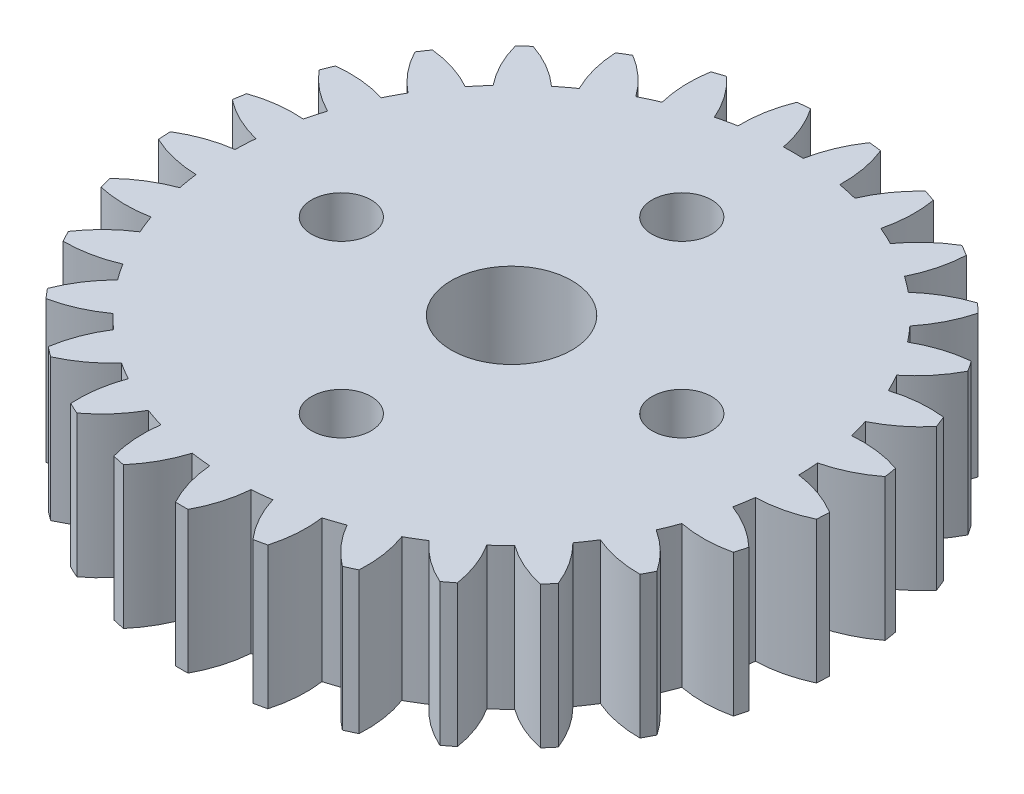
from build123d import *

# Parameters (mm, degrees)
SKETCH1_R               = 23.25
BOSS_EXTRUDE1_DEPTH     = 5
CUT_EXTRUDE1_DEPTH      = 34.258457571
CIRPATTERN1_COUNT       = 29
CUT_EXTRUDE2_DEPTH      = 35.357810434
CUT_EXTRUDE2_DEPTH_BACK = 35.357810434
SKETCH3_R               = 4.25
SKETCH4_R               = 2.1
CUT_EXTRUDE3_DEPTH      = 35.357810434
CIRPATTERN2_COUNT       = 4


with BuildPart() as part:
    # Sketch1 → Boss-Extrude1 (new, symmetric)
    with BuildSketch(Plane(origin=(0, 0, 0), x_dir=(1, 0, 0), z_dir=(0, 1, 0))):
        with Locations(Location((0, 0, 0), (0, 0, 270))):
            Circle(SKETCH1_R)
    extrude(amount=BOSS_EXTRUDE1_DEPTH, both=True)

    # Sketch2 → Cut-Extrude1 (cut, symmetric)
    with BuildSketch(Plane(origin=(0, 0, 0), x_dir=(1, 0, 0), z_dir=(0, 1, 0))):
        with BuildLine():
            ThreePointArc((0.696879992, 19.861778225), (0, 19.874), (-0.696879992, 19.861778225))
            ThreePointArc((-0.696879992, 19.861778225), (-1.219525976, 21.594414991), (-2.089327454, 23.181435589))
            ThreePointArc((-2.089327454, 23.181435589), (0, 23.2754), (2.089327454, 23.181435589))
            ThreePointArc((2.089327454, 23.181435589), (1.219525976, 21.594414991), (0.696879992, 19.861778225))
        make_face()
    cut_extrude1 = extrude(amount=CUT_EXTRUDE1_DEPTH, both=True, mode=Mode.SUBTRACT)

    # CirPattern1: Cut-Extrude1 ×29 about axis
    cirpattern1_axis = Axis((0, 0, 0), (0, 1, 0))
    for i in range(1, CIRPATTERN1_COUNT):
        add(cut_extrude1.rotate(cirpattern1_axis, i * 360 / CIRPATTERN1_COUNT), mode=Mode.SUBTRACT)

    # Sketch3 → Cut-Extrude2 (cut, two sides: drawn at the far end of the back side and taken through both)
    with BuildSketch(Plane(origin=(0, 5, 0), x_dir=(1, 0, 0), z_dir=(0, 1, 0)).offset(-CUT_EXTRUDE2_DEPTH_BACK)):
        with Locations(Location((0, 0, 0), (0, 0, 270))):
            Circle(SKETCH3_R)
    extrude(amount=CUT_EXTRUDE2_DEPTH + CUT_EXTRUDE2_DEPTH_BACK, mode=Mode.SUBTRACT)

    # Sketch4 → Cut-Extrude3 (cut, symmetric)
    with BuildSketch(Plane(origin=(0, 5, 0), x_dir=(1, 0, 0), z_dir=(0, 1, 0))):
        with Locations(Location((0, -12, 0), (0, 0, 270))):
            Circle(SKETCH4_R)
    cut_extrude3 = extrude(amount=CUT_EXTRUDE3_DEPTH, both=True, mode=Mode.SUBTRACT)

    # CirPattern2: Cut-Extrude3 ×4 about axis
    cirpattern2_axis = Axis((0, 0, 0), (0, 1, 0))
    for i in range(1, CIRPATTERN2_COUNT):
        add(cut_extrude3.rotate(cirpattern2_axis, i * 360 / CIRPATTERN2_COUNT), mode=Mode.SUBTRACT)


solid = part.part
